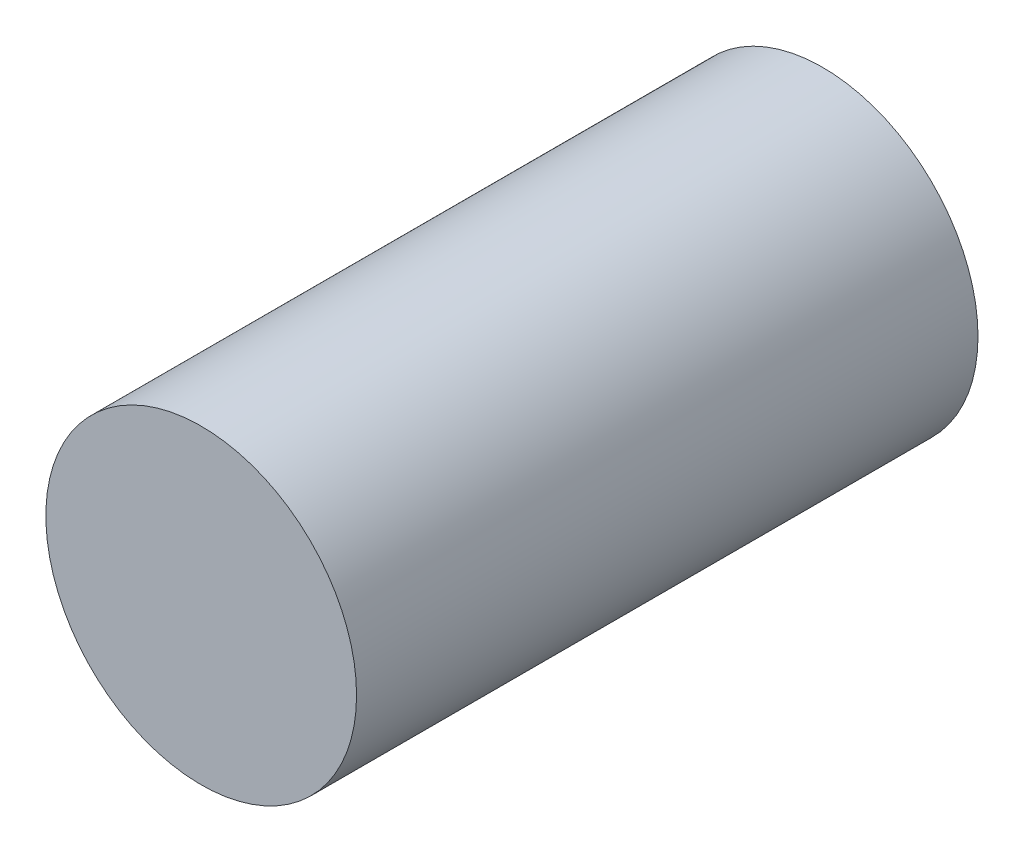
from build123d import *

# Parameters (mm, degrees)
SKETCH_1_R      = 50
EXTRUDE_1_DEPTH = 200


with BuildPart() as part:
    # ｽｹｯﾁ1 → ﾎﾞｽ - 押し出し1 (new body)
    with BuildSketch(Plane.XY):
        Circle(SKETCH_1_R)
    extrude(amount=EXTRUDE_1_DEPTH)


solid = part.part
